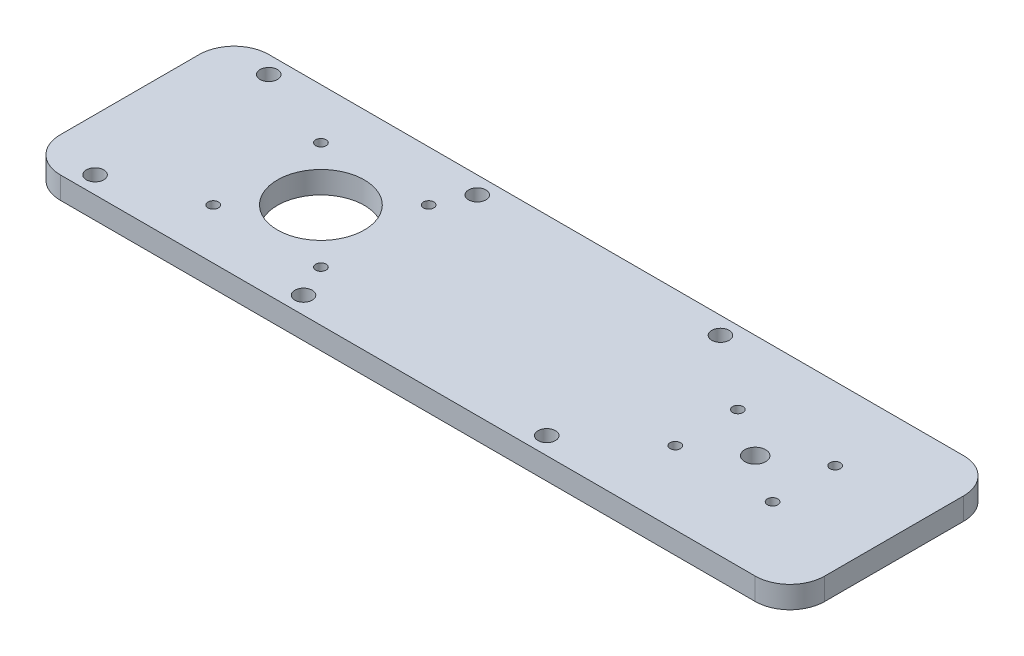
from build123d import *

# Parameters (mm, degrees)
SKETCH1_W             = 220
SKETCH1_H             = 60
BOSS_EXTRUDE1_DEPTH   = 6.35
FILLET1_R             = 10
F_3_0MM_DOWEL_HOLE1_D = 3
SKETCH6_R             = 12.5
CUT_EXTRUDE1_DEPTH    = 168.825273722
F_6_0MM_DOWEL_HOLE1_D = 6
F_3_0MM_DOWEL_HOLE2_D = 3
F_5_0MM_DOWEL_HOLE1_D = 5


with BuildPart() as part:
    # Sketch1 → Boss-Extrude1 (new body)
    with BuildSketch(Plane(origin=(0, 0, 0), x_dir=(1, 0, 0), z_dir=(0, 1, 0))):
        with Locations((55, 0)):
            Rectangle(SKETCH1_W, SKETCH1_H)
    extrude(amount=BOSS_EXTRUDE1_DEPTH)

    # Fillet1
    fillet1_edges = [part.edges().sort_by_distance(p)[0] for p in [
        (-55, 3.175, -30),
        (165, 3.175, -30),
        (165, 3.175, 30),
        (-55, 3.175, 30),
    ]]
    fillet(fillet1_edges, radius=FILLET1_R)

    # Ø3.0mm Dowel Hole1 (through all)
    with Locations(Plane(origin=(0, 6.35, 0), x_dir=(1, 0, 0), z_dir=(0, 1, 0))):
        with Locations((-15.5, 15.5), (15.5, 15.5), (15.5, -15.5), (-15.5, -15.5)):
            Hole(F_3_0MM_DOWEL_HOLE1_D / 2)

    # Sketch6 → Cut-Extrude1 (cut, through all)
    with BuildSketch(Plane(origin=(0, 6.35, 0), x_dir=(1, 0, 0), z_dir=(0, 1, 0))):
        with Locations(Location((0, 0, 0), (0, 0, 270))):
            Circle(SKETCH6_R)
    extrude(amount=-CUT_EXTRUDE1_DEPTH, mode=Mode.SUBTRACT)

    # Ø6.0mm Dowel Hole1 (through all)
    with Locations(Plane(origin=(0, 6.35, 0), x_dir=(1, 0, 0), z_dir=(0, 1, 0))):
        with Locations((125, 0)):
            Hole(F_6_0MM_DOWEL_HOLE1_D / 2)

    # Ø3.0mm Dowel Hole2 (through all)
    with Locations(Plane(origin=(0, 0, 0), x_dir=(-1, 0, 0), z_dir=(0, -1, 0))):
        with Locations((-139, 9), (-111, 9), (-111, -9), (-139, -9)):
            Hole(F_3_0MM_DOWEL_HOLE2_D / 2)

    # Ø5.0mm Dowel Hole1 (through all)
    with Locations(Plane(origin=(0, 6.35, 0), x_dir=(1, 0, 0), z_dir=(0, 1, 0))):
        with Locations((20, -25), (90, -25), (90, 25), (20, 25), (-40, -25), (-40, 25)):
            Hole(F_5_0MM_DOWEL_HOLE1_D / 2)


solid = part.part
